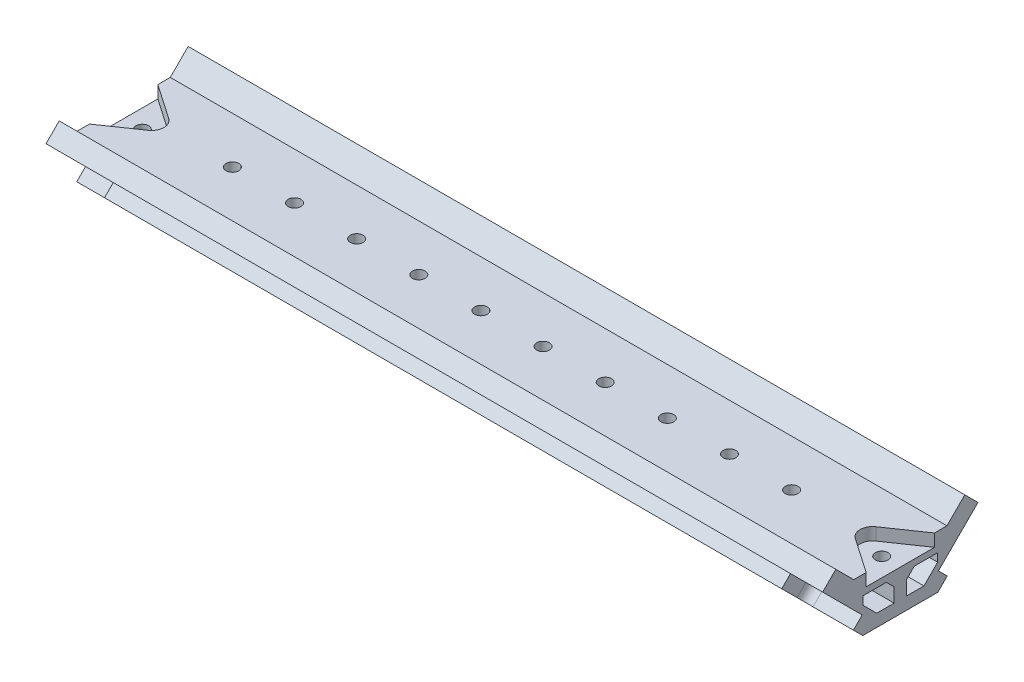
from build123d import *

# Parameters (mm, degrees)
BOSS_EXTRUDE1_DEPTH      = 125
BOSS_EXTRUDE1_DEPTH_BACK = 125
SKETCH1_W                = 50
SKETCH1_H                = 30
CUT_EXTRUDE1_DEPTH       = 254.031618578
CUT_EXTRUDE2_DEPTH       = 254.031618578
CUT_EXTRUDE3_DEPTH       = 254.031618578
SKETCH6_R                = 2.05
CUT_EXTRUDE4_DEPTH       = 6
CUT_EXTRUDE5_DEPTH       = 253.477691783
BOSS_EXTRUDE2_DEPTH      = 250
BOSS_EXTRUDE3_DEPTH      = 250
CUT_EXTRUDE6_DEPTH       = 253.477691783
SKETCH11_W               = 16
SKETCH11_H               = 10
CUT_EXTRUDE7_DEPTH       = 4
SKETCH12_W               = 16
SKETCH12_H               = 18
CUT_EXTRUDE11_DEPTH      = 4
BOSS_EXTRUDE4_DEPTH      = 250
CUT_EXTRUDE12_DEPTH      = 4
SKETCH15_W               = 30
SKETCH15_H               = 2
BOSS_EXTRUDE5_DEPTH      = 250
FILLET1_R                = 4
FILLET2_R                = 3
SKETCH16_R               = 2.05
CUT_EXTRUDE13_DEPTH      = 6
SKETCH17_R               = 2.05
CUT_EXTRUDE14_DEPTH      = 6
SKETCH18_R               = 2.05
CUT_EXTRUDE15_DEPTH      = 6


with BuildPart() as part:
    # Sketch1 → Boss-Extrude1 (new, two sides: drawn at the far end of the back side and taken through both)
    with BuildSketch(Plane(origin=(0, 0, 0), x_dir=(0, 0, -1), z_dir=(1, 0, 0)).offset(-BOSS_EXTRUDE1_DEPTH_BACK)):
        with Locations((0, 15)):
            Rectangle(SKETCH1_W, SKETCH1_H)
    extrude(amount=BOSS_EXTRUDE1_DEPTH + BOSS_EXTRUDE1_DEPTH_BACK)

    # Sketch2 → Cut-Extrude1 (cut, through all)
    with BuildSketch(Plane(origin=(125, 0, 0), x_dir=(0, 0, -1), z_dir=(1, 0, 0))):
        Polygon((-10, 0), (-25, 15), (-25, 0), align=None)
        Polygon((25, 15), (10, 0), (25, 0), align=None)
    extrude(amount=-CUT_EXTRUDE1_DEPTH, mode=Mode.SUBTRACT)

    # Sketch4 → Cut-Extrude2 (cut, through all)
    with BuildSketch(Plane(origin=(125, 0, 0), x_dir=(0, 0, -1), z_dir=(1, 0, 0))):
        Polygon((-22.171572875, 12.171572875), (-19.343145751, 15), (-25, 20.656854249), (-25, 15), align=None)
        Polygon((22.171572875, 12.171572875), (19.343145751, 15), (25, 20.656854249), (25, 15), align=None)
    extrude(amount=-CUT_EXTRUDE2_DEPTH, mode=Mode.SUBTRACT)

    # Sketch5 → Cut-Extrude3 (cut, through all)
    with BuildSketch(Plane(origin=(125, 0, 0), x_dir=(0, 0, -1), z_dir=(1, 0, 0))):
        Polygon((-25, 20.656854249), (-20.757359313, 24.899494937), (-15, 19.142135624), (15, 19.142135624), (20.757359313, 24.899494937), (25, 20.656854249), (25, 30), (-25, 30), align=None)
    extrude(amount=-CUT_EXTRUDE3_DEPTH, mode=Mode.SUBTRACT)

    # Sketch6 → Cut-Extrude4 (cut)
    with BuildSketch(Plane(origin=(0, 19.142135624, 0), x_dir=(1, 0, 0), z_dir=(0, 1, 0))):
        with Locations(Location((-10, 0, 0), (0, 0, 270))):
            Circle(SKETCH6_R)
        with Locations(Location((10, 0, 0), (0, 0, 270))):
            Circle(SKETCH6_R)
        with Locations(Location((30, 0, 0), (0, 0, 270))):
            Circle(SKETCH6_R)
        with Locations(Location((50, 0, 0), (0, 0, 270))):
            Circle(SKETCH6_R)
        with Locations(Location((70, 0, 0), (0, 0, 270))):
            Circle(SKETCH6_R)
        with Locations(Location((90, 0, 0), (0, 0, 270))):
            Circle(SKETCH6_R)
        with Locations(Location((-30, 0, 0), (0, 0, 270))):
            Circle(SKETCH6_R)
        with Locations(Location((-50, 0, 0), (0, 0, 270))):
            Circle(SKETCH6_R)
        with Locations(Location((-70, 0, 0), (0, 0, 270))):
            Circle(SKETCH6_R)
        with Locations(Location((-90, 0, 0), (0, 0, 270))):
            Circle(SKETCH6_R)
    extrude(amount=-CUT_EXTRUDE4_DEPTH, mode=Mode.SUBTRACT)

    # Sketch7 → Cut-Extrude5 (cut, through all)
    with BuildSketch(Plane.ZY.offset(125)):
        Polygon((-8.343145751, 4), (-2, 4), (-2, 10.647041832), (-6.495093791, 15.142135624), (-10.495093791, 15.142135624), (-14.990187583, 10.647041832), align=None)
        Polygon((8.343145751, 4), (14.990187583, 10.647041832), (10.495093791, 15.142135624), (6.495093791, 15.142135624), (2, 10.647041832), (2, 4), align=None)
    extrude(amount=-CUT_EXTRUDE5_DEPTH, mode=Mode.SUBTRACT)

    # Sketch8 → Boss-Extrude2 (add, through all)
    with BuildSketch(Plane.ZY.offset(125)):
        Polygon((-12, 13.637229415), (-12, 7.656854249), (-14.990187583, 10.647041832), align=None)
        Polygon((12, 13.637229415), (12, 7.656854249), (14.990187583, 10.647041832), align=None)
    extrude(amount=-BOSS_EXTRUDE2_DEPTH)

    # Sketch9 → Boss-Extrude3 (add, through all)
    with BuildSketch(Plane(origin=(125, 0, 0), x_dir=(0, 0, -1), z_dir=(1, 0, 0))):
        Polygon((-16.085786438, 6.085786438), (16.085786438, 6.085786438), (10, 0), (-10, 0), align=None)
    extrude(amount=-BOSS_EXTRUDE3_DEPTH)

    # Sketch10 → Cut-Extrude6 (cut, through all)
    with BuildSketch(Plane(origin=(125, 0, 0), x_dir=(0, 0, -1), z_dir=(1, 0, 0))):
        Polygon((-12.085786438, 2.085786438), (12.085786438, 2.085786438), (10, 0), (-10, 0), align=None)
    extrude(amount=-CUT_EXTRUDE6_DEPTH, mode=Mode.SUBTRACT)

    # Sketch11 → Cut-Extrude7 (cut)
    with BuildSketch(Plane(origin=(0, -5, 5), x_dir=(1, 0, 0), z_dir=(0, -0.7071067811865477, 0.7071067811865475))):
        with Locations((117, 19.284271247)):
            Rectangle(SKETCH11_W, SKETCH11_H)
        with Locations((-117, 19.284271247)):
            Rectangle(SKETCH11_W, SKETCH11_H)
    extrude(amount=-CUT_EXTRUDE7_DEPTH, mode=Mode.SUBTRACT)

    # Sketch12 → Cut-Extrude11 (cut)
    with BuildSketch(Plane(origin=(0, -5, -5), x_dir=(-1, 0, 0), z_dir=(0, -0.7071067811865477, -0.7071067811865475))):
        with Locations((-117, 23.284271247)):
            Rectangle(SKETCH12_W, SKETCH12_H)
        with Locations((117, 23.284271247)):
            Rectangle(SKETCH12_W, SKETCH12_H)
    extrude(amount=-CUT_EXTRUDE11_DEPTH, mode=Mode.SUBTRACT)

    # Sketch13 → Boss-Extrude4 (add, through all)
    with BuildSketch(Plane(origin=(125, 0, 0), x_dir=(0, 0, -1), z_dir=(1, 0, 0))):
        Polygon((7.600505063, 6.085786438), (13.514718626, 12), (14.928932188, 10.585786438), (10.428932188, 6.085786438), align=None)
        Polygon((-7.600505063, 6.085786438), (-13.514718626, 12), (-14.928932188, 10.585786438), (-10.428932188, 6.085786438), align=None)
    extrude(amount=-BOSS_EXTRUDE4_DEPTH)

    # Sketch14 → Cut-Extrude12 (cut)
    with BuildSketch(Plane(origin=(0, 19.142135624, 0), x_dir=(1, 0, 0), z_dir=(0, 1, 0))):
        Polygon((125, 11), (109, 0), (125, -11), align=None)
        Polygon((-125, 11), (-109, 0), (-125, -11), align=None)
    extrude(amount=-CUT_EXTRUDE12_DEPTH, mode=Mode.SUBTRACT)

    # Sketch15 → Boss-Extrude5 (add, through all)
    with BuildSketch(Plane.ZY.offset(125)):
        with Locations((0, 14.142135624)):
            Rectangle(SKETCH15_W, SKETCH15_H)
    extrude(amount=-BOSS_EXTRUDE5_DEPTH)

    # Fillet1
    fillet1_edges = [part.edges().sort_by_distance(p)[0] for p in [
        (109, 17.142135624, 0),
        (-109, 17.142135624, 0),
    ]]
    fillet(fillet1_edges, radius=FILLET1_R)

    # Fillet2
    fillet2_edges = [part.edges().sort_by_distance(p)[0] for p in [
        (109, 6.514718626, 13.686291501),
        (-109, 6.514718626, 13.686291501),
        (109, 6.514718626, -13.686291501),
        (-109, 6.514718626, -13.686291501),
    ]]
    fillet(fillet2_edges, radius=FILLET2_R)

    # Sketch16 → Cut-Extrude13 (cut)
    with BuildSketch(Plane(origin=(0, 15.142135624, 0), x_dir=(1, 0, 0), z_dir=(0, 1, 0))):
        with Locations(Location((119, 0, 0), (0, 0, 270))):
            Circle(SKETCH16_R)
        with Locations(Location((-119, 0, 0), (0, 0, 270))):
            Circle(SKETCH16_R)
    extrude(amount=-CUT_EXTRUDE13_DEPTH, mode=Mode.SUBTRACT)

    # Sketch17 → Cut-Extrude14 (cut)
    with BuildSketch(Plane(origin=(0, -2.171572875, -2.171572875), x_dir=(-1, 0, 0), z_dir=(0, -0.7071067811865469, -0.7071067811865481))):
        with Locations(Location((-115, 19.284271247, 0), (0, 0, 90))):
            Circle(SKETCH17_R)
        with Locations(Location((115, 19.284271247, 0), (0, 0, 90))):
            Circle(SKETCH17_R)
    extrude(amount=-CUT_EXTRUDE14_DEPTH, mode=Mode.SUBTRACT)

    # Sketch18 → Cut-Extrude15 (cut)
    with BuildSketch(Plane(origin=(0, -2.171572875, 2.171572875), x_dir=(1, 0, 0), z_dir=(0, -0.7071067811865477, 0.7071067811865475))):
        with Locations(Location((-115, 19.284271247, 0), (0, 0, 270))):
            Circle(SKETCH18_R)
        with Locations(Location((115, 19.284271247, 0), (0, 0, 270))):
            Circle(SKETCH18_R)
    extrude(amount=-CUT_EXTRUDE15_DEPTH, mode=Mode.SUBTRACT)


solid = part.part
